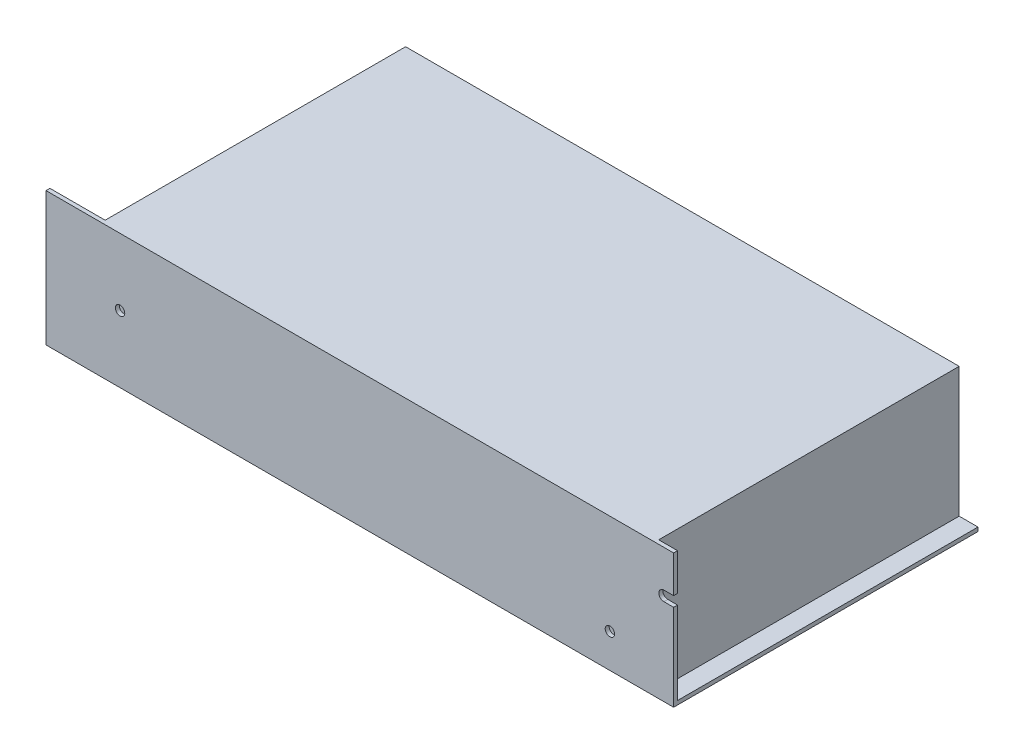
from build123d import *

# Parameters (mm, degrees)
SZKIC1_W                    = 200
SZKIC1_H                    = 97
DODANIE_WYCI_GNI_CIE1_DEPTH = 1.25
SZKIC2_W                    = 200
SZKIC2_H                    = 1.25
DODANIE_WYCI_GNI_CIE2_DEPTH = 42.6
SZKIC4_R                    = 1.5
SZKIC4_R_2                  = 1.746235722
WYTNIJ_WYCI_GNI_CIE1_DEPTH  = 1.25
SZKIC5_W                    = 182.404557989
SZKIC5_H                    = 95.75
DODANIE_WYCI_GNI_CIE3_DEPTH = 41.35
SZKIC6_W                    = 17.595442011
SZKIC6_H                    = 88.898428246
DODANIE_WYCI_GNI_CIE4_DEPTH = 22
SZKIC3_R                    = 1.5
WYTNIJ_WYCI_GNI_CIE2_DEPTH  = 1.25
SZKIC7_W                    = 95.75
SZKIC7_H                    = 41.35
WYTNIJ_WYCI_GNI_CIE3_DEPTH  = 6


with BuildPart() as part:
    # Szkic1 → Dodanie-wyciągnięcie1 (new body)
    with BuildSketch(Plane(origin=(0, 0, 0), x_dir=(1, 0, 0), z_dir=(0, 1, 0))):
        with Locations((39.453125, 6.3828125)):
            Rectangle(SZKIC1_W, SZKIC1_H)
    extrude(amount=DODANIE_WYCI_GNI_CIE1_DEPTH)

    # Szkic2 → Dodanie-wyciągnięcie2 (add)
    with BuildSketch(Plane.XZ):
        with Locations((39.453125, 41.4921875)):
            Rectangle(SZKIC2_W, SZKIC2_H)
    extrude(amount=-DODANIE_WYCI_GNI_CIE2_DEPTH)

    # Szkic4 → Wytnij-wyciągnięcie1 (cut)
    with BuildSketch(Plane.XZ):
        with Locations(Location((121.653125, -38.6328125, 0), (0, 0, 270))):
            Circle(SZKIC4_R)
        with Locations(Location((121.653125, 25.8671875, 0), (0, 0, 270))):
            Circle(SZKIC4_R)
        with Locations(Location((17.106889278, -38.6328125, 0), (0, 0, 270))):
            Circle(SZKIC4_R_2)
        with Locations(Location((17.353125, 25.8671875, 0), (0, 0, 270))):
            Circle(SZKIC4_R)
    extrude(amount=-WYTNIJ_WYCI_GNI_CIE1_DEPTH, mode=Mode.SUBTRACT)

    # Szkic5 → Dodanie-wyciągnięcie3 (add)
    with BuildSketch(Plane(origin=(0, 1.25, 0), x_dir=(1, 0, 0), z_dir=(0, 1, 0))):
        with Locations((48.250846005, 7.0078125)):
            Rectangle(SZKIC5_W, SZKIC5_H)
    extrude(amount=DODANIE_WYCI_GNI_CIE3_DEPTH)

    # Szkic6 → Dodanie-wyciągnięcie4 (add)
    with BuildSketch(Plane(origin=(0, 1.25, 0), x_dir=(1, 0, 0), z_dir=(0, 1, 0))):
        with Locations((-51.749153995, 10.433598377)):
            Rectangle(SZKIC6_W, SZKIC6_H)
    extrude(amount=DODANIE_WYCI_GNI_CIE4_DEPTH)

    # Szkic3 → Wytnij-wyciągnięcie2 (cut)
    with BuildSketch(Plane.XY.offset(42.1171875)):
        with Locations((119.153125, 10.8)):
            Circle(SZKIC3_R)
        with Locations((-36.946875, 21.3)):
            Circle(SZKIC3_R)
        with BuildLine():
            Line((136.353125, 30.8), (139.453125, 30.8))
            Line((139.453125, 30.8), (139.453125, 27.6))
            Line((139.453125, 27.6), (136.353125, 27.6))
            ThreePointArc((136.353125, 27.6), (134.753125, 29.2), (136.353125, 30.8))
        make_face()
    extrude(amount=-WYTNIJ_WYCI_GNI_CIE2_DEPTH, mode=Mode.SUBTRACT)

    # Szkic7 → Wytnij-wyciągnięcie3 (cut)
    with BuildSketch(Plane(origin=(139.453125, 0, 0), x_dir=(0, 0, -1), z_dir=(1, 0, 0))):
        with Locations((7.0078125, 21.925)):
            Rectangle(SZKIC7_W, SZKIC7_H)
    extrude(amount=-WYTNIJ_WYCI_GNI_CIE3_DEPTH, mode=Mode.SUBTRACT)


solid = part.part
